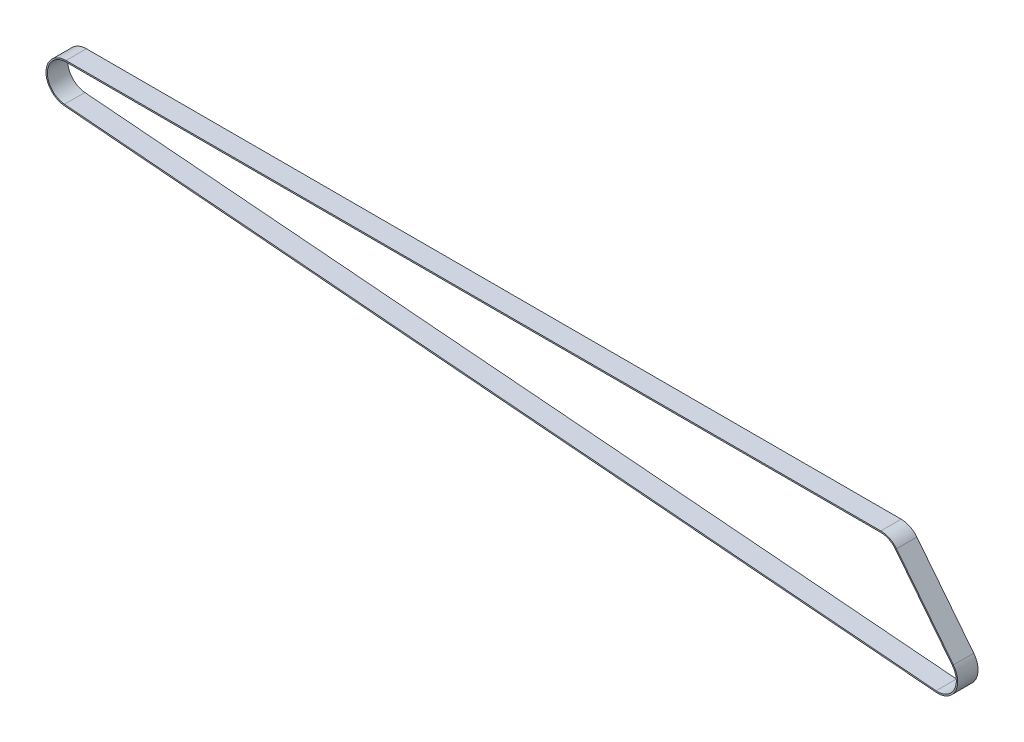
from build123d import *

# Parameters (mm, degrees)
LINEAR_AUSTRAGEN_D_NN1_DEPTH = 6


with BuildPart() as part:
    # Skizze1 → Linear-Austragen-Dünn1 (new, symmetric)
    with BuildSketch(Plane.XY):
        with BuildLine():
            Line((-240, 11.8), (240, 11.8))
            ThreePointArc((240, 11.8), (245.149960176, 10.616869133), (249.267195462, 7.304730541))
            Line((249.267195462, 7.304730541), (282.767195462, -35.195269459))
            ThreePointArc((282.767195462, -35.195269459), (283.895246845, -48.083801843), (272.526696959, -54.259790865))
            Line((272.526696959, -54.259790865), (-240.973303041, -11.759790865))
            ThreePointArc((-240.973303041, -11.759790865), (-251.789943431, 0.487066624), (-240, 11.8))
        make_face()
        with BuildLine():
            Line((-240, 11), (240, 11))
            ThreePointArc((240, 11), (244.800810333, 9.897081395), (248.638911024, 6.809494572))
            Line((248.638911024, 6.809494572), (282.138911024, -35.690505428))
            ThreePointArc((282.138911024, -35.690505428), (283.190484347, -47.705239006), (272.592683605, -53.462516908))
            Line((272.592683605, -53.462516908), (-240.907316395, -10.962516908))
            ThreePointArc((-240.907316395, -10.962516908), (-250.990625232, 0.454045158), (-240, 11))
        make_face(mode=Mode.SUBTRACT)
    extrude(amount=LINEAR_AUSTRAGEN_D_NN1_DEPTH, both=True)


solid = part.part
